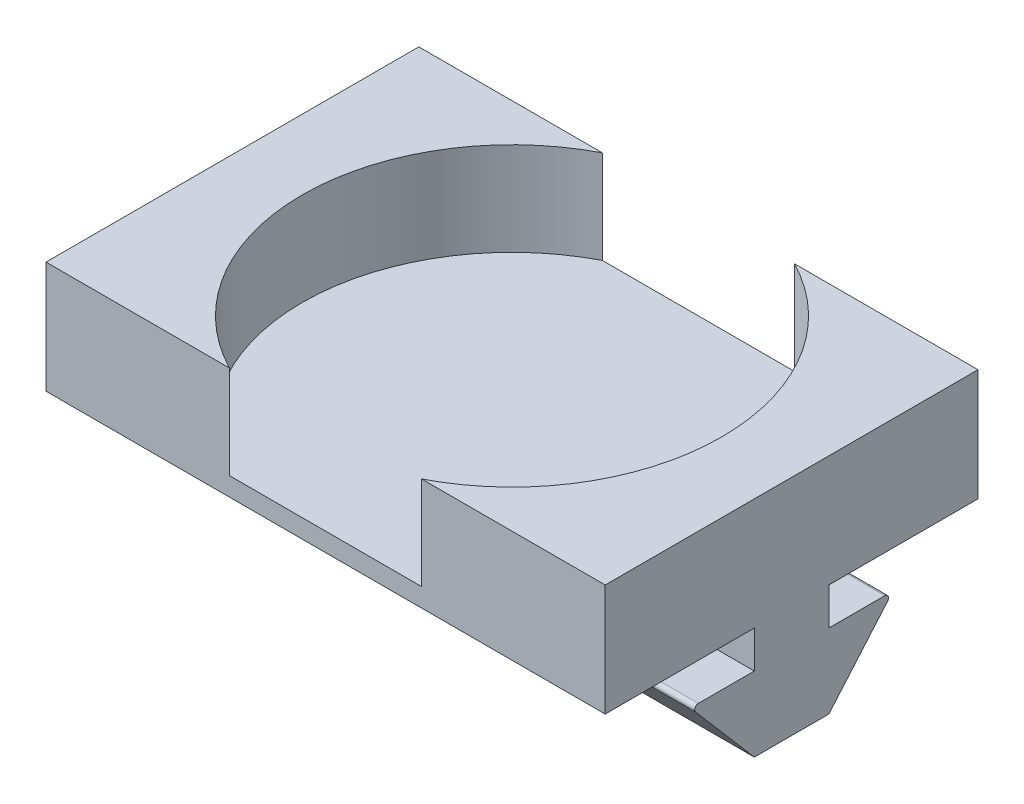
from build123d import *

# Parameters (mm, degrees)
SKETCH10_W          = 5.08
SKETCH10_H          = 2.54
BOSS_EXTRUDE3_DEPTH = 38.1
SKETCH11_W          = 38.1
SKETCH11_H          = 25.4
BOSS_EXTRUDE4_DEPTH = 7.62
SKETCH12_R          = 14.2875
CUT_EXTRUDE1_DEPTH  = 6.35


with BuildPart() as part:
    # Sketch10 → Boss-Extrude3 (new body)
    with BuildSketch(Plane(origin=(0, 0, 0), x_dir=(0, 0, -1), z_dir=(1, 0, 0))):
        with BuildLine():
            Line((6.35, 10.16), (-6.35, 10.16))
            ThreePointArc((-6.35, 10.16), (-6.580814495, 10.012022021), (-6.542688341, 9.740509205))
            Line((-6.542688341, 9.740509205), (-2.54, 5.08))
            Line((-2.54, 5.08), (2.54, 5.08))
            Line((2.54, 5.08), (6.542688341, 9.740509205))
            ThreePointArc((6.542688341, 9.740509205), (6.580814495, 10.012022021), (6.35, 10.16))
        make_face()
        with Locations((0, 11.43)):
            Rectangle(SKETCH10_W, SKETCH10_H)
    extrude(amount=-BOSS_EXTRUDE3_DEPTH)

    # Sketch11 → Boss-Extrude4 (add)
    with BuildSketch(Plane(origin=(0, 12.7, 0), x_dir=(1, 0, 0), z_dir=(0, 1, 0))):
        with Locations((-19.05, 0)):
            Rectangle(SKETCH11_W, SKETCH11_H)
    extrude(amount=BOSS_EXTRUDE4_DEPTH)

    # Sketch12 → Cut-Extrude1 (cut)
    with BuildSketch(Plane(origin=(0, 20.32, 0), x_dir=(1, 0, 0), z_dir=(0, 1, 0))):
        with Locations((-19.05, 0)):
            Circle(SKETCH12_R)
    extrude(amount=-CUT_EXTRUDE1_DEPTH, mode=Mode.SUBTRACT)


solid = part.part
